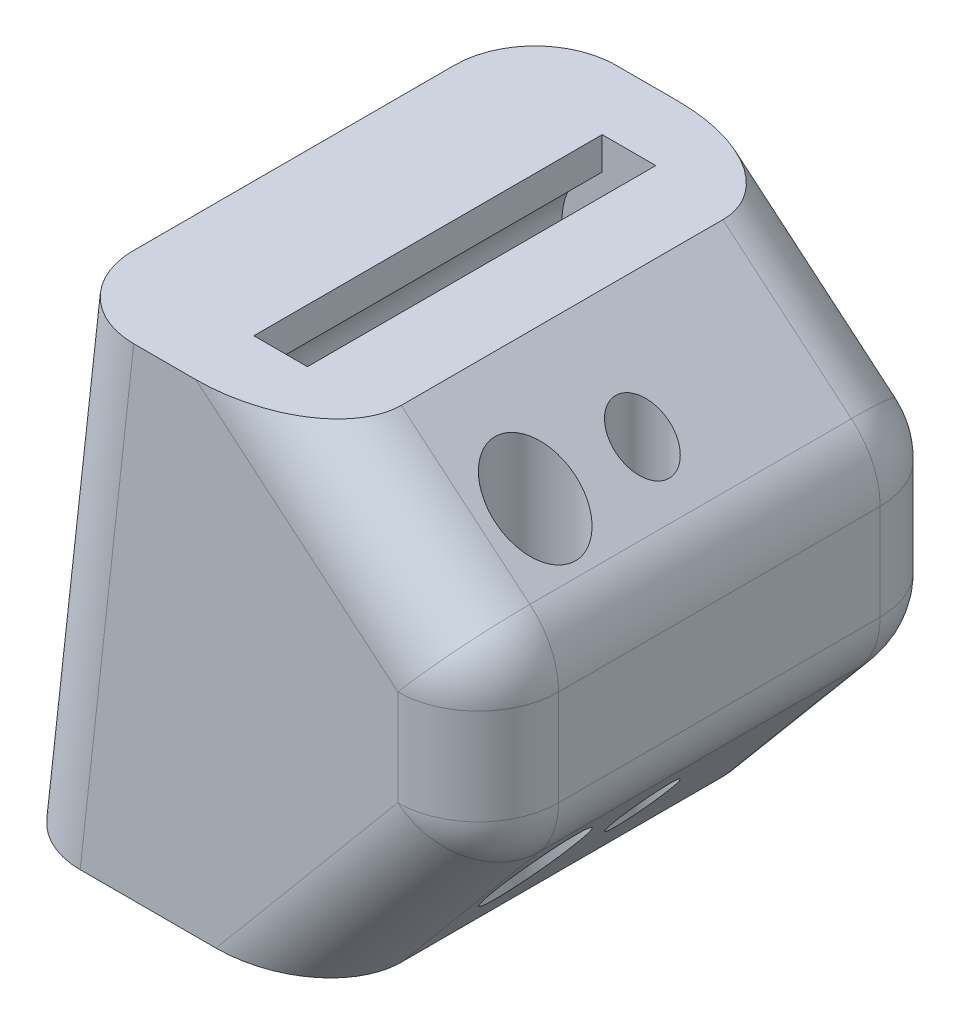
from build123d import *

# Parameters (mm, degrees)
BOSS_EXTRUDE1_DEPTH = 18
CUT_EXTRUDE1_START  = -2.5
CUT_EXTRUDE1_DEPTH  = 13
CUT_EXTRUDE2_START  = -2.5
CUT_EXTRUDE2_DEPTH  = 13
SKETCH5_R           = 1
SKETCH5_R_2         = 1.5
CUT_EXTRUDE3_DEPTH  = 25
FILLET1_R           = 3


with BuildPart() as part:
    # Sketch2 → Boss-Extrude1 (new body)
    with BuildSketch(Plane.XY):
        with BuildLine():
            Line((0, 0), (12, 0))
            Line((12, 0), (17.171830748, 6.163547874))
            ThreePointArc((17.171830748, 6.163547874), (17.692775281, 7.065850273), (17.873697418, 8.091910703))
            Line((17.873697418, 8.091910703), (17.873697418, 11.672459688))
            ThreePointArc((17.873697418, 11.672459688), (17.592620779, 12.940314473), (16.802060247, 13.970593018))
            Line((16.802060247, 13.970593018), (12, 18))
            Line((12, 18), (2, 18))
            Line((2, 18), (0, 0))
        make_face()
    extrude(amount=BOSS_EXTRUDE1_DEPTH)

    # Sketch3 → Cut-Extrude1 (cut)
    with BuildSketch(Plane.XY.offset(18).offset(CUT_EXTRUDE1_START)):
        with BuildLine():
            Line((7, 18), (9, 18))
            Line((9, 18), (9, 16.791287847))
            ThreePointArc((9, 16.791287847), (8, 12), (7, 16.791287847))
            Line((7, 16.791287847), (7, 18))
        make_face()
    extrude(amount=-CUT_EXTRUDE1_DEPTH, mode=Mode.SUBTRACT)

    # Sketch4 → Cut-Extrude2 (cut)
    with BuildSketch(Plane(origin=(0, 0, 0), x_dir=(-1, 0, 0), z_dir=(0, 0, -1)).offset(CUT_EXTRUDE2_START)):
        with BuildLine():
            Line((-9, 0), (-7, 0))
            Line((-7, 0), (-7, 1.208712153))
            ThreePointArc((-7, 1.208712153), (-8, 6), (-9, 1.208712153))
            Line((-9, 1.208712153), (-9, 0))
        make_face()
    extrude(amount=-CUT_EXTRUDE2_DEPTH, mode=Mode.SUBTRACT)

    # Sketch5 → Cut-Extrude3 (cut)
    with BuildSketch(Plane(origin=(0, 0, 0), x_dir=(1, 0, 0), z_dir=(0, 1, 0))):
        with Locations((15, -9)):
            Circle(SKETCH5_R)
        with Locations((15, -13)):
            Circle(SKETCH5_R_2)
    extrude(amount=CUT_EXTRUDE3_DEPTH, mode=Mode.SUBTRACT)

    # Fillet1
    fillet1_edges = [part.edges().sort_by_distance(p)[0] for p in [
        (17.692775281, 7.065850273, 0),
        (14.585915374, 3.081773937, 0),
        (1, 9, 0),
        (14.585915374, 3.081773937, 18),
        (17.692775281, 7.065850273, 18),
        (17.873697418, 9.882185196, 18),
        (17.592620779, 12.940314473, 18),
        (14.401030124, 15.985296509, 18),
        (1, 9, 18),
        (14.401030124, 15.985296509, 0),
        (17.592620779, 12.940314473, 0),
        (17.873697418, 9.882185196, 0),
    ]]
    fillet(fillet1_edges, radius=FILLET1_R)


solid = part.part
